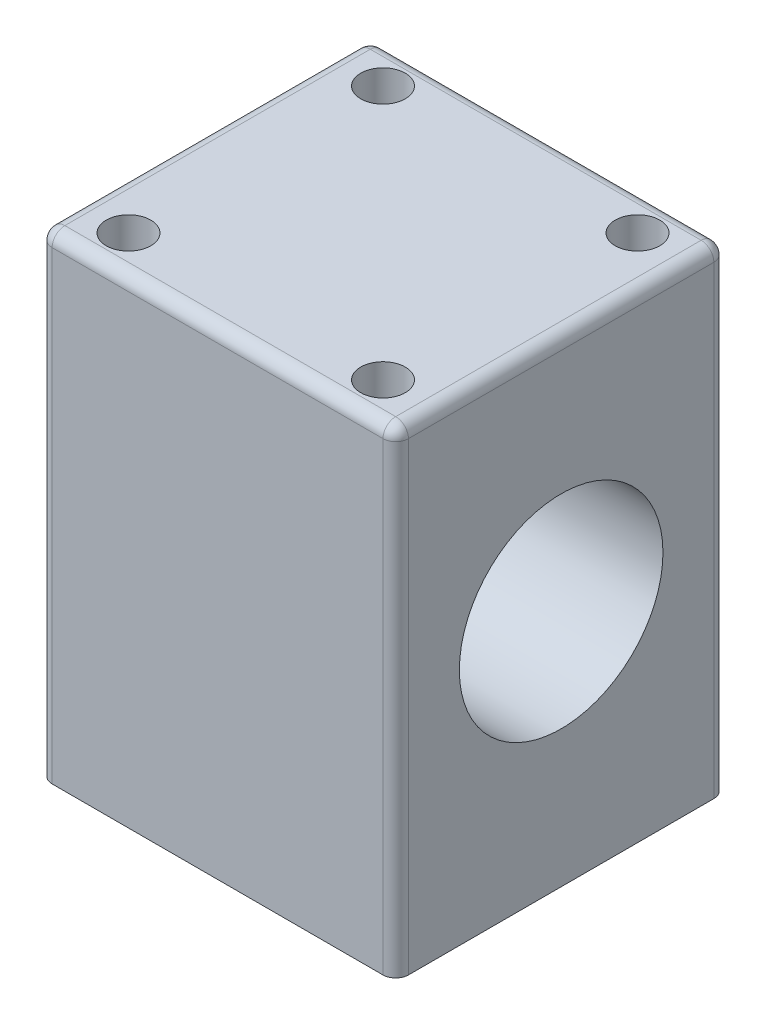
from build123d import *

# Parameters (mm, degrees)
SKETCH1_W           = 26
SKETCH1_H           = 37.5
SKETCH1_R           = 8
BOSS_EXTRUDE1_DEPTH = 14
SKETCH2_R           = 1.75
CUT_EXTRUDE1_DEPTH  = 32
SKETCH5_R           = 8.35
SKETCH5_R_2         = 6
BOSS_EXTRUDE3_DEPTH = 3
FILLET3_R           = 1


with BuildPart() as part:
    # Sketch1 → Boss-Extrude1 (new, symmetric)
    with BuildSketch(Plane(origin=(0, 0, 0), x_dir=(0, 0, -1), z_dir=(1, 0, 0))):
        Rectangle(SKETCH1_W, SKETCH1_H)
        Circle(SKETCH1_R, mode=Mode.SUBTRACT)
    extrude(amount=BOSS_EXTRUDE1_DEPTH, both=True)

    # Sketch2 → Cut-Extrude1 (cut)
    with BuildSketch(Plane(origin=(0, 18.75, 0), x_dir=(1, 0, 0), z_dir=(0, 1, 0))):
        with Locations(Location((-10, 10, 0), (0, 0, 270))):
            Circle(SKETCH2_R)
        with Locations(Location((10, 10, 0), (0, 0, 270))):
            Circle(SKETCH2_R)
        with Locations(Location((10, -10, 0), (0, 0, 270))):
            Circle(SKETCH2_R)
        with Locations(Location((-10, -10, 0), (0, 0, 270))):
            Circle(SKETCH2_R)
    extrude(amount=-CUT_EXTRUDE1_DEPTH, mode=Mode.SUBTRACT)

    # Sketch5 → Boss-Extrude3 (add)
    with BuildSketch(Plane.ZY.offset(14)):
        Circle(SKETCH5_R)
        Circle(SKETCH5_R_2, mode=Mode.SUBTRACT)
    extrude(amount=-BOSS_EXTRUDE3_DEPTH)

    # Fillet3
    fillet3_edges = [part.edges().sort_by_distance(p)[0] for p in [
        (14, 0, 13),
        (14, 0, -13),
        (-14, 0, 13),
        (-14, 18.75, 0),
        (-14, 0, -13),
        (0, 18.75, 13),
        (0, 18.75, -13),
        (14, 18.75, 0),
    ]]
    fillet(fillet3_edges, radius=FILLET3_R)


solid = part.part
